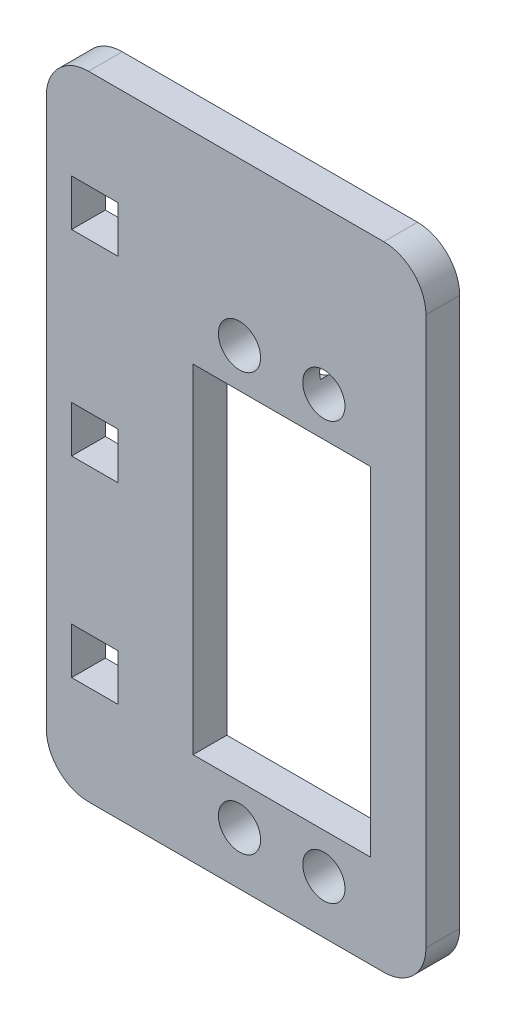
from build123d import *

# Parameters (mm, degrees)
SKETCH_4_R          = 2.5
SKETCH_4_W          = 21
SKETCH_4_H          = 40.1
EXTRUDE_1_DEPTH     = 4
SKETCH_5_W          = 5.5
SKETCH_5_H          = 5.5
CUT_EXTRUDE_5_DEPTH = 10
FILLET_1_R          = 5
SKETCH_6_R          = 3
CUT_EXTRUDE_6_DEPTH = 2


with BuildPart() as part:
    # 草图4 → 凸台-拉伸1 (new body)
    with BuildSketch(Plane.XY):
        Polygon((-30.514243596, -31.085830111), (-0.514243596, -31.085830111), (-0.514243596, 43.914169889), (-30.514243596, 43.914169889), (-45.514243596, 43.914169889), (-45.514243596, -31.085830111), align=None)
        with Locations((-22.614243596, 24.699169889)):
            Circle(SKETCH_4_R, mode=Mode.SUBTRACT)
        with Locations((-12.614243596, 24.699169889)):
            Circle(SKETCH_4_R, mode=Mode.SUBTRACT)
        with Locations((-12.614243596, -24.800830111)):
            Circle(SKETCH_4_R, mode=Mode.SUBTRACT)
        with Locations((-22.614243596, -24.800830111)):
            Circle(SKETCH_4_R, mode=Mode.SUBTRACT)
        with Locations((-17.614243596, -0.000830111)):
            Rectangle(SKETCH_4_W, SKETCH_4_H, mode=Mode.SUBTRACT)
    extrude(amount=EXTRUDE_1_DEPTH)

    # 草图5 → 切除-拉伸5 (cut)
    with BuildSketch(Plane(origin=(0, 0, 0), x_dir=(-1, 0, 0), z_dir=(0, 0, -1))):
        Polygon((42.514243596, 3.414169889), (42.514243596, 6.414169889), (42.514243596, 8.914169889), (37.014243596, 8.914169889), (37.014243596, 3.414169889), align=None)
        with Locations((39.764243596, 29.414169889)):
            Rectangle(SKETCH_5_W, SKETCH_5_H)
        with Locations((39.764243596, -16.585830111)):
            Rectangle(SKETCH_5_W, SKETCH_5_H)
    extrude(amount=-CUT_EXTRUDE_5_DEPTH, mode=Mode.SUBTRACT)

    # 圆角1
    fillet_1_edges = [part.edges().sort_by_distance(p)[0] for p in [
        (-45.514243596, -31.085830111, 2),
        (-45.514243596, 43.914169889, 2),
        (-0.514243596, 43.914169889, 2),
        (-0.514243596, -31.085830111, 2),
    ]]
    fillet(fillet_1_edges, radius=FILLET_1_R)

    # 草图6 → 切除-拉伸6 (cut)
    with BuildSketch(Plane(origin=(0, 0, 0), x_dir=(-1, 0, 0), z_dir=(0, 0, -1))):
        with Locations((17.614243596, 25.504169889)):
            Circle(SKETCH_6_R)
    extrude(amount=-CUT_EXTRUDE_6_DEPTH, mode=Mode.SUBTRACT)


solid = part.part
